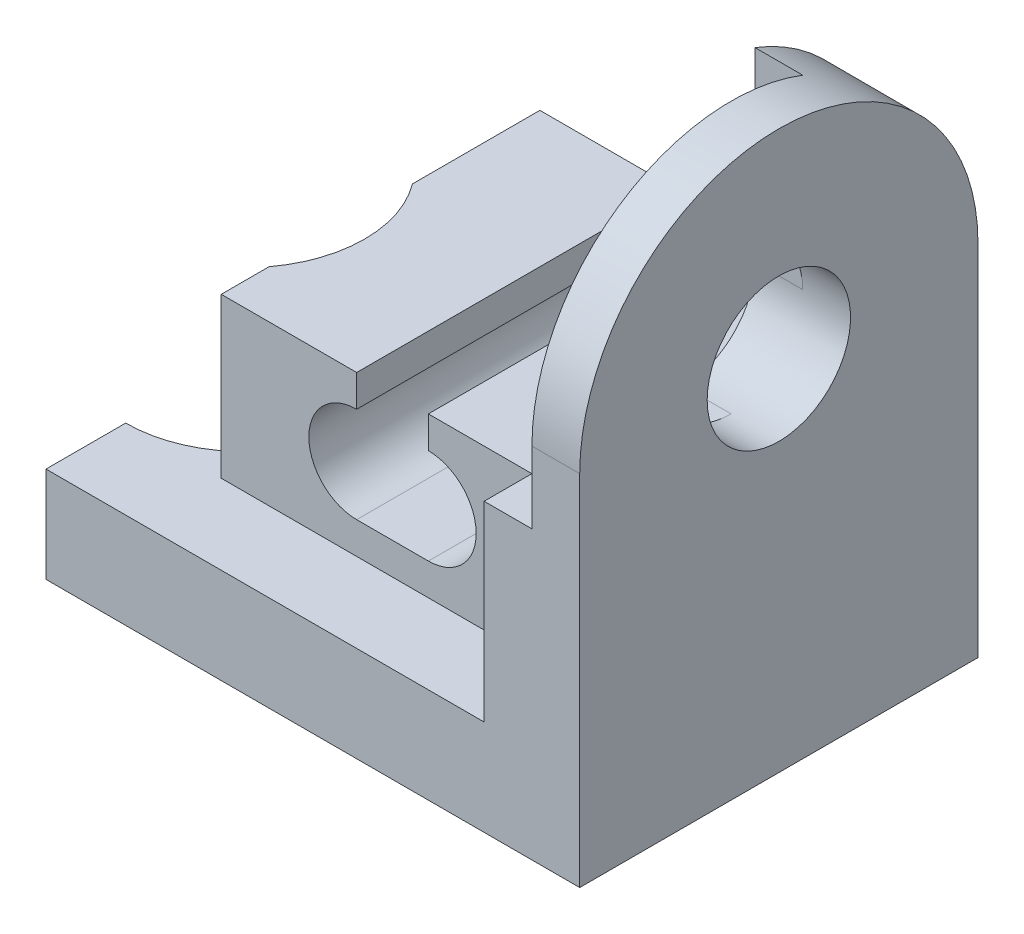
from build123d import *

# Parameters (mm, degrees)
BOSS_EXTRUDE1_DEPTH      = 25
BOSS_EXTRUDE1_DEPTH_BACK = 25
BOSS_EXTRUDE2_DEPTH      = 15
BOSS_EXTRUDE2_DEPTH_BACK = 25
SKETCH2_R                = 15
CUT_EXTRUDE1_DEPTH       = 101.069975517
CUT_EXTRUDE2_DEPTH       = 93.466210045
SKETCH3_6_R              = 9
CUT_EXTRUDE3_DEPTH       = 93.466210045
CUT_EXTRUDE4_DEPTH       = 6


with BuildPart() as part:
    # Sketch1 → Boss-Extrude1 (new, two sides: drawn at the far end of the back side and taken through both)
    with BuildSketch(Plane.XY.offset(-BOSS_EXTRUDE1_DEPTH_BACK)):
        Polygon((-14.682422452, 0), (0, 0), (0, 10.443131462), (0, 70), (-12, 70), (-12, 32), (-12, 12), (-55, 12), (-67, 12), (-67, 0), align=None)
    extrude(amount=BOSS_EXTRUDE1_DEPTH + BOSS_EXTRUDE1_DEPTH_BACK)

    # Sketch1<3> → Boss-Extrude2 (add, two sides: drawn at the far end of the back side and taken through both)
    with BuildSketch(Plane.XY.offset(-BOSS_EXTRUDE2_DEPTH_BACK)):
        with BuildLine():
            Line((-55, 32), (-55, 12))
            Line((-55, 12), (-12, 12))
            Line((-12, 12), (-12, 32))
            Line((-12, 32), (-29, 32))
            Line((-29, 32), (-29, 28.000000026))
            ThreePointArc((-29, 28.000000026), (-23, 22.000000026), (-29, 16.000000026))
            Line((-29, 16.000000026), (-37.999206574, 16.000000026))
            ThreePointArc((-37.999206574, 16.000000026), (-44.000000013, 21.999603287), (-38, 28.000000026))
            Line((-38, 28.000000026), (-38, 32))
            Line((-38, 32), (-55, 32))
        make_face()
    extrude(amount=BOSS_EXTRUDE2_DEPTH + BOSS_EXTRUDE2_DEPTH_BACK)

    # Sketch2 → Cut-Extrude1 (cut, through all)
    with BuildSketch(Plane.XZ):
        with Locations((-67, 0)):
            Circle(SKETCH2_R)
    extrude(amount=-CUT_EXTRUDE1_DEPTH, mode=Mode.SUBTRACT)

    # Sketch3 → Cut-Extrude2 (cut, through all)
    with BuildSketch(Plane.ZY.offset(12)):
        with BuildLine():
            ThreePointArc((-25, 45), (-17.67766953, 62.67766953), (0, 70))
            Line((0, 70), (-25, 70))
            Line((-25, 70), (-25, 45))
        make_face()
        with BuildLine():
            Line((25, 70), (0, 70))
            ThreePointArc((0, 70), (17.67766953, 62.67766953), (25, 45))
            Line((25, 45), (25, 70))
        make_face()
    extrude(amount=-CUT_EXTRUDE2_DEPTH, mode=Mode.SUBTRACT)

    # Sketch3<6> → Cut-Extrude3 (cut, through all)
    with BuildSketch(Plane.ZY.offset(12)):
        with Locations((0, 45)):
            Circle(SKETCH3_6_R)
    extrude(amount=-CUT_EXTRUDE3_DEPTH, mode=Mode.SUBTRACT)

    # Sketch3<7> → Cut-Extrude4 (cut)
    with BuildSketch(Plane.ZY.offset(12)):
        with BuildLine():
            Line((-9, 68.323807579), (-9, 45))
            ThreePointArc((-9, 45), (6.363961031, 51.363961031), (0, 36))
            Line((0, 36), (25, 36))
            Line((25, 36), (25, 45))
            ThreePointArc((25, 45), (14.142135624, 65.615528128), (-9, 68.323807579))
        make_face()
    extrude(amount=-CUT_EXTRUDE4_DEPTH, mode=Mode.SUBTRACT)


solid = part.part
